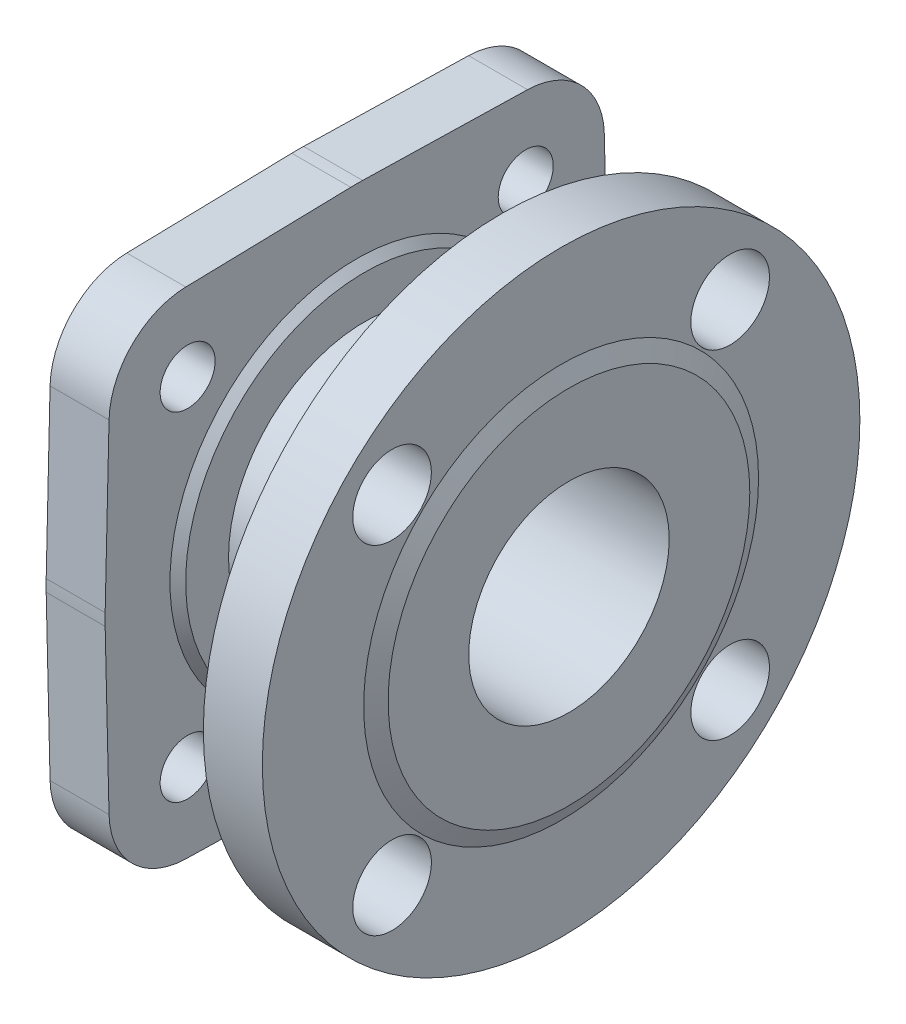
from build123d import *

# Parameters (mm, degrees)
BOSS_EXTRUDE1_DEPTH = 15
SKETCH3_R           = 7
CUT_EXTRUDE1_DEPTH  = 15
SKETCH7_R           = 25.5
CUT_EXTRUDE2_DEPTH  = 128.72235513
SKETCH10_R          = 10
CUT_EXTRUDE3_DEPTH  = 25


with BuildPart() as part:
    # Sketch2 → Boss-Extrude1 (new body)
    with BuildSketch(Plane(origin=(0, 0, 0), x_dir=(0, 0, -1), z_dir=(1, 0, 0))):
        with BuildLine():
            Line((62.994461331, -43.470654948), (63.982276259, -1.506095834))
            ThreePointArc((63.982276259, -1.506095834), (64, 0), (63.982276259, 1.506095834))
            Line((63.982276259, 1.506095834), (62.994461331, 43.470654948))
            ThreePointArc((62.994461331, 43.470654948), (57.142135624, 57.142135624), (43.470654948, 62.994461331))
            Line((43.470654948, 62.994461331), (1.506095834, 63.982276259))
            ThreePointArc((1.506095834, 63.982276259), (0, 64), (-1.506095834, 63.982276259))
            Line((-1.506095834, 63.982276259), (-43.470654948, 62.994461331))
            ThreePointArc((-43.470654948, 62.994461331), (-57.142135624, 57.142135624), (-62.994461331, 43.470654948))
            Line((-62.994461331, 43.470654948), (-63.982276259, 1.506095834))
            ThreePointArc((-63.982276259, 1.506095834), (-64, 0), (-63.982276259, -1.506095834))
            Line((-63.982276259, -1.506095834), (-62.994461331, -43.470654948))
            ThreePointArc((-62.994461331, -43.470654948), (-57.142135624, -57.142135624), (-43.470654948, -62.994461331))
            Line((-43.470654948, -62.994461331), (-1.506095834, -63.982276259))
            ThreePointArc((-1.506095834, -63.982276259), (0, -64), (1.506095834, -63.982276259))
            Line((1.506095834, -63.982276259), (43.470654948, -62.994461331))
            ThreePointArc((43.470654948, -62.994461331), (57.142135624, -57.142135624), (62.994461331, -43.470654948))
        make_face()
    extrude(amount=BOSS_EXTRUDE1_DEPTH)

    # Sketch3 → Cut-Extrude1 (cut)
    with BuildSketch(Plane(origin=(15, 0, 0), x_dir=(0, 0, -1), z_dir=(1, 0, 0))):
        with Locations((-43, 43)):
            Circle(SKETCH3_R)
        with Locations(Location((43, 43, 0), (0, 0, 180))):
            Circle(SKETCH3_R)
        with Locations((43, -43)):
            Circle(SKETCH3_R)
        with Locations(Location((-43, -43, 0), (0, 0, 180))):
            Circle(SKETCH3_R)
    extrude(amount=-CUT_EXTRUDE1_DEPTH, mode=Mode.SUBTRACT)

    # Sketch4 → Revolve1 (revolve)
    with BuildSketch(Plane.XY, mode=Mode.PRIVATE) as revolve1_sk:
        Polygon((15, 0), (15, 47.5), (17, 45.5), (17, 34.6), (34, 34.6), (52, 39.423085464), (52, 76), (67, 76), (67, 50.228310139), (69, 46), (69, 0), align=None)
    revolve(revolve1_sk.sketch.rotate(Axis((69, 0, 0), (-1, 0, 0)), 90), axis=Axis((69, 0, 0), (-1, 0, 0)))

    # Sketch7 → Cut-Extrude2 (cut, through all)
    with BuildSketch(Plane(origin=(69, 0, 0), x_dir=(0, 0, -1), z_dir=(1, 0, 0))):
        Circle(SKETCH7_R)
    extrude(amount=-CUT_EXTRUDE2_DEPTH, mode=Mode.SUBTRACT)

    # Sketch10 → Cut-Extrude3 (cut)
    with BuildSketch(Plane(origin=(67, 0, 0), x_dir=(0, 0, -1), z_dir=(1, 0, 0))):
        with Locations((-43, 43)):
            Circle(SKETCH10_R)
        with Locations(Location((43, 43, 0), (0, 0, 180))):
            Circle(SKETCH10_R)
        with Locations((43, -43)):
            Circle(SKETCH10_R)
        with Locations(Location((-43, -43, 0), (0, 0, 180))):
            Circle(SKETCH10_R)
    extrude(amount=-CUT_EXTRUDE3_DEPTH, mode=Mode.SUBTRACT)


solid = part.part
